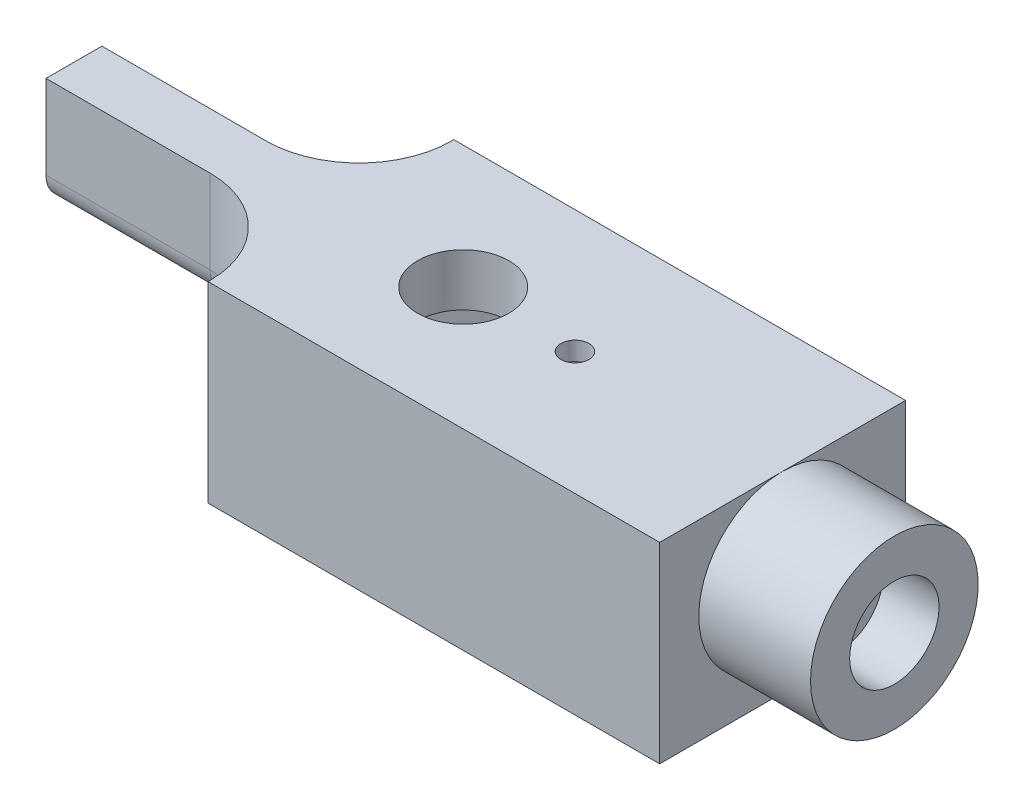
from build123d import *
from build123d.topology import SkipClean

# Parameters (mm, degrees)
ESQUISSE2_W             = 24.25
ESQUISSE2_H             = 13.2
ESQUISSE2_R             = 0.5
BOSS_EXTRU_1_DEPTH      = 9.3
ESQUISSE3_W             = 24.25
ESQUISSE3_H             = 13.2
ESQUISSE3_R             = 2.45
ESQUISSE3_R_2           = 0.75
BOSS_EXTRU_2_DEPTH      = 1
ESQUISSE4_R             = 1
ENL_V_MAT_EXTRU_1_DEPTH = 29.992455915
ESQUISSE5_W             = 13.8
ESQUISSE5_H             = 1
BOSS_EXTRU_3_DEPTH      = 13.8
CONG_1_R                = 5
BOSS_EXTRU_4_START      = 1.8
ESQUISSE8_R             = 3.45
ESQUISSE8_R_2           = 2.45
BOSS_EXTRU_4_DEPTH      = 1.8
ESQUISSE9_R             = 0.7
ENL_V_MAT_EXTRU_2_DEPTH = 8


with BuildPart() as part:
    # Esquisse2 → Boss.-Extru.1 (new body)
    with BuildSketch(Plane(origin=(0, 0, 0), x_dir=(1, 0, 0), z_dir=(0, 1, 0))):
        with Locations((11.025, 5.5)):
            Rectangle(ESQUISSE2_W, ESQUISSE2_H)
        Polygon((0, 8.5), (2.5, 11), (19.55, 11), (22.05, 8.5), (22.05, 2.5), (19.55, 0), (2.5, 0), (0, 2.5), align=None, mode=Mode.SUBTRACT)
        with Locations(Location((0.5, 10.5, 0), (0, 0, 270))):
            Circle(ESQUISSE2_R, mode=Mode.SUBTRACT)
        with Locations(Location((21.55, 10.5, 0), (0, 0, 270))):
            Circle(ESQUISSE2_R, mode=Mode.SUBTRACT)
        with Locations(Location((0.5, 0.5, 0), (0, 0, 270))):
            Circle(ESQUISSE2_R, mode=Mode.SUBTRACT)
        with Locations(Location((21.55, 0.5, 0), (0, 0, 270))):
            Circle(ESQUISSE2_R, mode=Mode.SUBTRACT)
    extrude(amount=BOSS_EXTRU_1_DEPTH)

    # Esquisse3 → Boss.-Extru.2 (add)
    with BuildSketch(Plane(origin=(0, 9.3, 0), x_dir=(1, 0, 0), z_dir=(0, 1, 0))):
        with Locations((11.025, 5.5)):
            Rectangle(ESQUISSE3_W, ESQUISSE3_H)
        with Locations(Location((6, 5.5, 0), (0, 0, 270))):
            Circle(ESQUISSE3_R, mode=Mode.SUBTRACT)
        with Locations(Location((12, 5.5, 0), (0, 0, 270))):
            Circle(ESQUISSE3_R_2, mode=Mode.SUBTRACT)
    extrude(amount=BOSS_EXTRU_2_DEPTH)

    # Esquisse4 → Enlèv. mat.-Extru.1 (cut, through all)
    with BuildSketch(Plane(origin=(23.15, 0, 0), x_dir=(0, 0, -1), z_dir=(1, 0, 0))):
        with Locations((5.5, 5.8)):
            Circle(ESQUISSE4_R)
    extrude(amount=-ENL_V_MAT_EXTRU_1_DEPTH, mode=Mode.SUBTRACT)

    # Esquisse5 → Révolution1 (revolve)
    with BuildSketch(Plane.XY.offset(-5.5), mode=Mode.PRIVATE) as r_volution1_sk:
        with Locations((-8, 6.8)):
            Rectangle(ESQUISSE5_W, ESQUISSE5_H)
        Polygon((22.05, 10.3), (22.05, 5.8), (26.15, 5.8), (26.15, 8.2), (29.15, 8.2), (29.15, 10.3), align=None)
    revolve(r_volution1_sk.sketch.rotate(Axis((-19.031616201, 5.8, -5.5), (1, 0, 0)), 90), axis=Axis((-19.031616201, 5.8, -5.5), (1, 0, 0)))

    # Esquisse6 → Boss.-Extru.3 (add)
    with BuildSketch(Plane.ZY.offset(14.9)):
        with BuildLine():
            Line((-7, 5.8), (-7, 10.3))
            Line((-7, 10.3), (-4, 10.3))
            Line((-4, 10.3), (-4, 5.8))
            ThreePointArc((-4, 5.8), (-5.5, 7.3), (-7, 5.8))
        make_face()
    extrude(amount=-BOSS_EXTRU_3_DEPTH)

    # Congé1
    cong_1_edges = [part.edges().sort_by_distance(p)[0] for p in [
        (-1.1, 8.05, -4),
        (-1.1, 8.05, -7),
        (-1.1, 4.3, -5.5),
    ]]
    fillet(cong_1_edges, radius=CONG_1_R)

    # Esquisse8 → Boss.-Extru.4 (add)
    with SkipClean():  # the faces are left unmerged after this step: merging them gives an invalid solid
        with BuildSketch(Plane.XZ.offset(-9.3).offset(BOSS_EXTRU_4_START)):
            with Locations(Location((6, -5.5, 0), (0, 0, 90))):
                Circle(ESQUISSE8_R)
            with Locations(Location((6, -5.5, 0), (0, 0, 270))):
                Circle(ESQUISSE8_R_2, mode=Mode.SUBTRACT)
        extrude(amount=-BOSS_EXTRU_4_DEPTH)

    # Esquisse9 → Enlèv. mat.-Extru.2 (cut)
    with SkipClean():  # the faces are left unmerged after this step: merging them gives an invalid solid
        with BuildSketch(Plane.ZY.offset(14.9)):
            with Locations((-5.5, 5.8)):
                Circle(ESQUISSE9_R)
        extrude(amount=-ENL_V_MAT_EXTRU_2_DEPTH, mode=Mode.SUBTRACT)


solid = part.part
